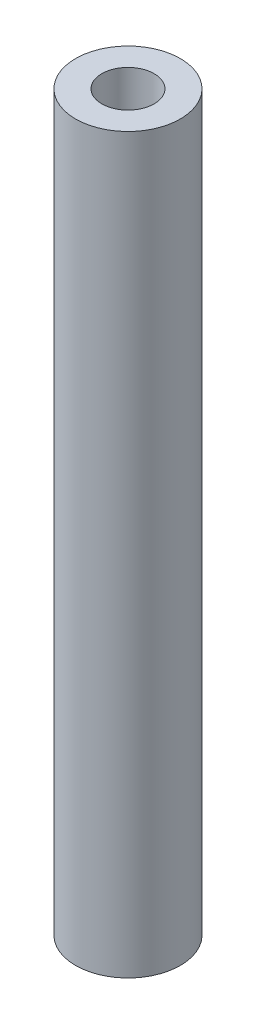
from build123d import *

# Parameters (mm, degrees)
SKETCH1_R           = 2.5
SKETCH1_R_2         = 1.25
BOSS_EXTRUDE1_DEPTH = 35


with BuildPart() as part:
    # Sketch1 → Boss-Extrude1 (new body)
    with BuildSketch(Plane(origin=(0, 0, 0), x_dir=(1, 0, 0), z_dir=(0, 1, 0))):
        with Locations(Location((0, 0, 0), (0, 0, 270))):
            Circle(SKETCH1_R)
        with Locations(Location((0, 0, 0), (0, 0, 270))):
            Circle(SKETCH1_R_2, mode=Mode.SUBTRACT)
    extrude(amount=BOSS_EXTRUDE1_DEPTH)


solid = part.part
